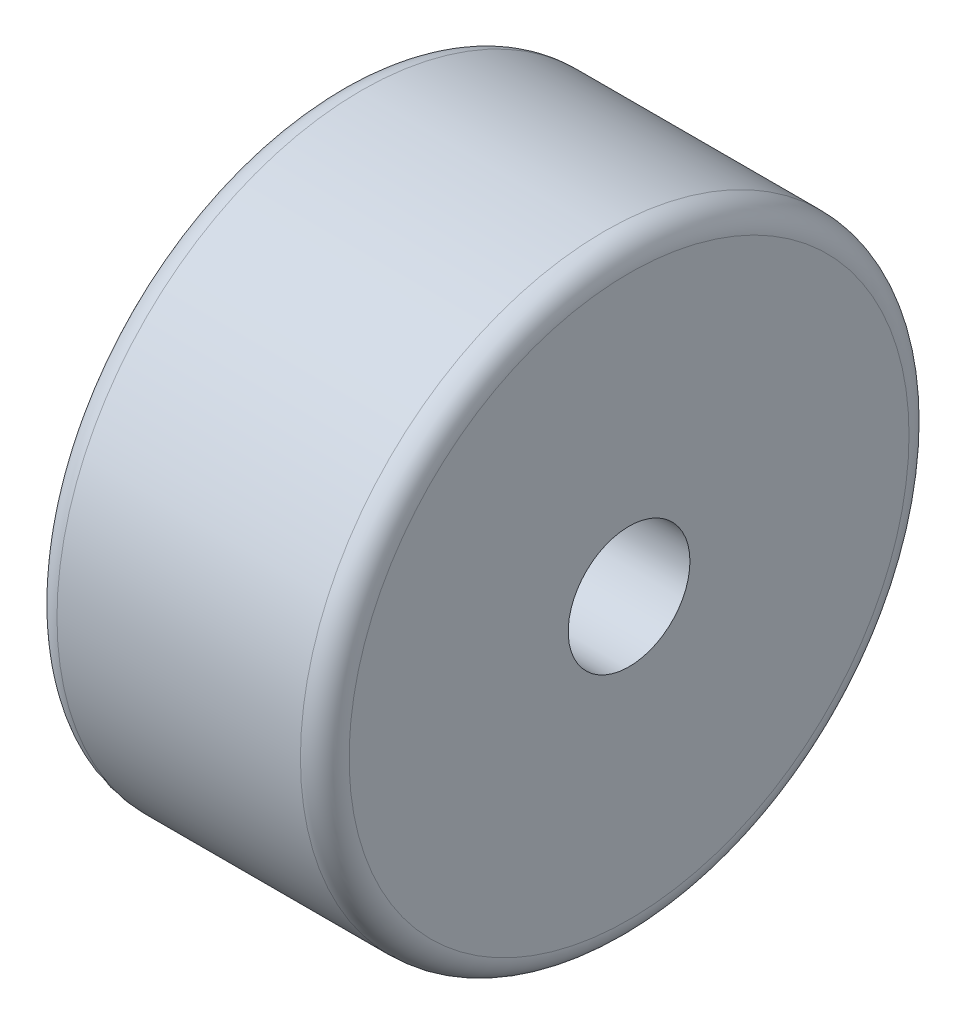
from build123d import *

# Parameters (mm, degrees)
ESQUISSE1_R             = 12.5
BOSS_EXTRU_1_DEPTH      = 12
ESQUISSE2_R             = 2.5
ENL_V_MAT_EXTRU_1_DEPTH = 12
CONG_1_R                = 1


with BuildPart() as part:
    # Esquisse1 → Boss.-Extru.1 (new body)
    with BuildSketch(Plane(origin=(0, 0, 0), x_dir=(0, 0, -1), z_dir=(1, 0, 0))):
        Circle(ESQUISSE1_R)
    extrude(amount=BOSS_EXTRU_1_DEPTH)

    # Esquisse2 → Enlèv. mat.-Extru.1 (cut)
    with BuildSketch(Plane(origin=(12, 0, 0), x_dir=(0, 0, -1), z_dir=(1, 0, 0))):
        Circle(ESQUISSE2_R)
    extrude(amount=-ENL_V_MAT_EXTRU_1_DEPTH, mode=Mode.SUBTRACT)

    # Congé1
    cong_1_edges = [part.edges().sort_by_distance(p)[0] for p in [
        (0, 0, 12.5),
        (12, 0, 12.5),
    ]]
    fillet(cong_1_edges, radius=CONG_1_R)


solid = part.part
